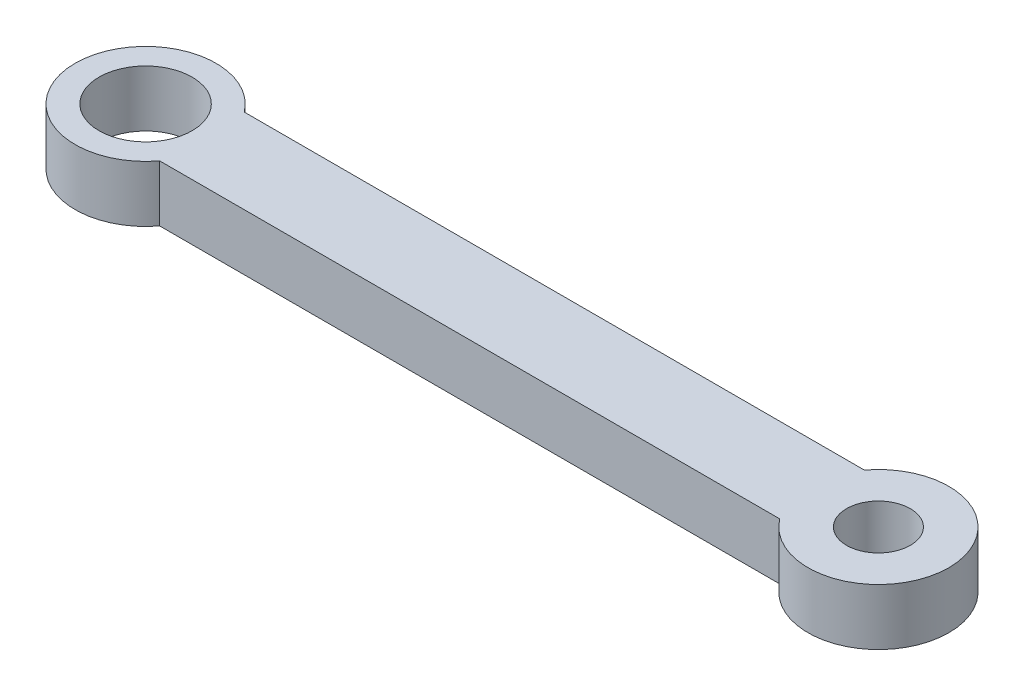
from build123d import *

# Parameters (mm, degrees)
SKETCH1_R           = 1.65
SKETCH1_R_2         = 1.1303
BOSS_EXTRUDE1_DEPTH = 2


with BuildPart() as part:
    # Sketch1 → Boss-Extrude1 (new body)
    with BuildSketch(Plane(origin=(0, 0, 0), x_dir=(1, 0, 0), z_dir=(0, 1, 0))):
        with BuildLine():
            Line((-11, 1.5), (11, 1.5))
            ThreePointArc((11, 1.5), (15.5, 0), (11, -1.5))
            Line((11, -1.5), (-11, -1.5))
            ThreePointArc((-11, -1.5), (-15.5, 0), (-11, 1.5))
        make_face()
        with Locations(Location((-13, 0, 0), (0, 0, 270))):
            Circle(SKETCH1_R, mode=Mode.SUBTRACT)
        with Locations(Location((13, 0, 0), (0, 0, 270))):
            Circle(SKETCH1_R_2, mode=Mode.SUBTRACT)
    extrude(amount=BOSS_EXTRUDE1_DEPTH)


solid = part.part
